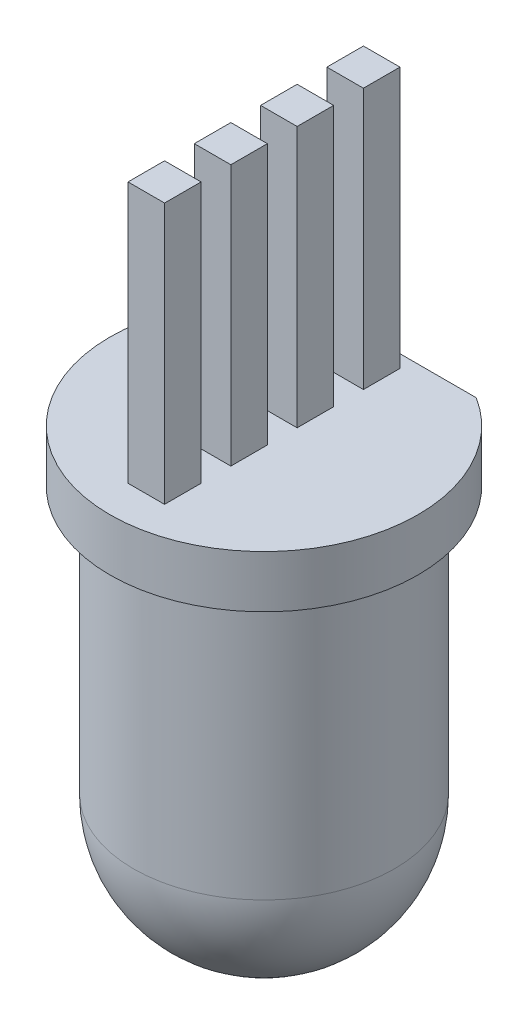
from build123d import *

# Parameters (mm, degrees)
ENL_V_MAT_EXTRU_1_REACH = 10.67
ESQUISSE3_W             = 0.7
ESQUISSE3_H             = 0.7
BOSS_EXTRU_1_DEPTH      = 24.5
ENL_V_START             = -3.3
ENL_V_MAT_EXTRU_2_DEPTH = 5.9
SKETCH1_W               = 4.51
SKETCH1_H               = 19.5
CUT_EXTRUDE1_DEPTH      = 34.394647775


with BuildPart() as part:
    # Esquisse1 → Révolution1 (revolve)
    with BuildSketch(Plane.XY):
        with BuildLine():
            Line((2.5, 7.6), (2.5, 2.5))
            ThreePointArc((2.5, 2.5), (1.767766953, 0.732233047), (0, 0))
            Line((0, 0), (0, 8.6))
            Line((0, 8.6), (2.95, 8.6))
            Line((2.95, 8.6), (2.95, 7.6))
            Line((2.95, 7.6), (2.5, 7.6))
        make_face()
    revolve(axis=Axis((0, 0, 0), (0, 1, 0)))

    # Esquisse2 → Enlèv. mat.-Extru.1 (cut, up to next)
    with BuildSketch(Plane(origin=(0, 7.6, 0), x_dir=(-1, 0, 0), z_dir=(0, -1, 0)), mode=Mode.PRIVATE) as enl_v_mat_extru_1_sk1:
        Polygon((2.031643218, 2.5), (-2.119175806, 2.5), (-0.304277426, 5.41579693), align=None)
    enl_v_mat_extru_1_tool1 = extrude(enl_v_mat_extru_1_sk1.sketch, amount=-ENL_V_MAT_EXTRU_1_REACH, mode=Mode.PRIVATE) & part.part
    add(enl_v_mat_extru_1_tool1.solids().sort_by_distance((0.130603, 7.6, -3.471932))[0], mode=Mode.SUBTRACT)

    # Esquisse3 → Boss.-Extru.1 (add)
    with BuildSketch(Plane(origin=(0, 8.6, 0), x_dir=(1, 0, 0), z_dir=(0, 1, 0))):
        with Locations((0, 1.905)):
            Rectangle(ESQUISSE3_W, ESQUISSE3_H)
        with Locations((0, -0.635)):
            Rectangle(ESQUISSE3_W, ESQUISSE3_H)
        with Locations((0, -1.905)):
            Rectangle(ESQUISSE3_W, ESQUISSE3_H)
        with Locations((0, 0.635)):
            Rectangle(ESQUISSE3_W, ESQUISSE3_H)
    extrude(amount=BOSS_EXTRU_1_DEPTH)

    # Esquisse4 → Enlèv. mat.-Extru.2 (cut)
    with BuildSketch(Plane.ZY.offset(0.35).offset(ENL_V_START)):
        Polygon((-2.885095567, 30.6), (-1.265657514, 30.6), (-1.265657514, 33.921907916), (0, 33.921907916), (0, 31.83), (1.344412991, 31.83), (1.344412991, 30.6), (2.897512796, 30.6), (2.897512796, 34.676886987), (-2.885095567, 34.676886987), align=None)
    extrude(amount=ENL_V_MAT_EXTRU_2_DEPTH, mode=Mode.SUBTRACT)

    # Sketch1 → Cut-Extrude1 (cut, through all)
    with BuildSketch(Plane.ZY.offset(0.35)):
        with Locations((0, 23.35)):
            Rectangle(SKETCH1_W, SKETCH1_H)
    extrude(amount=-CUT_EXTRUDE1_DEPTH, mode=Mode.SUBTRACT)


solid = part.part
